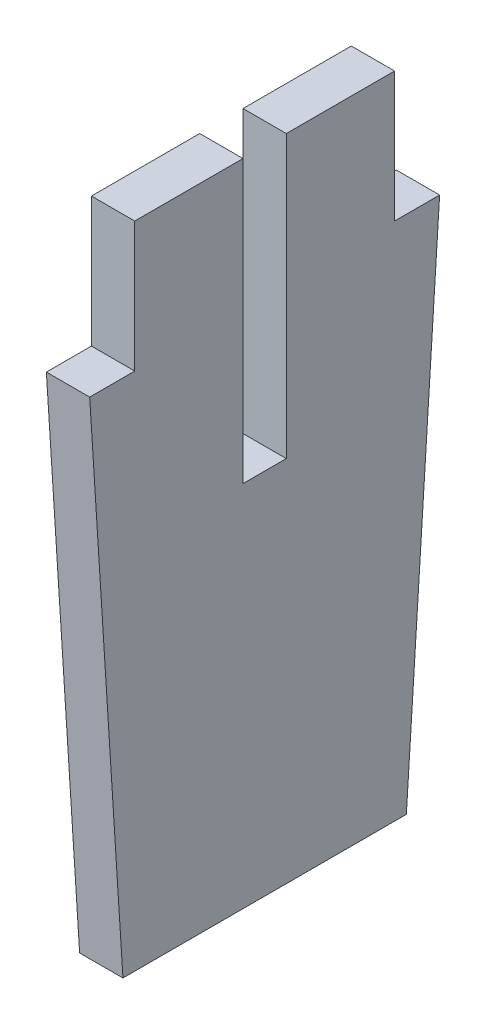
from build123d import *

# Parameters (mm, degrees)
BOSS_EXTRUDE1_DEPTH = 3.175


with BuildPart() as part:
    # Sketch1 → Boss-Extrude1 (new body)
    with BuildSketch(Plane(origin=(0, 0, 0), x_dir=(0, 0, -1), z_dir=(1, 0, 0))):
        Polygon((0, 47.625), (7.9375, 47.625), (7.9375, 26.9875), (11.1125, 26.9875), (11.1125, 47.625), (19.05, 47.625), (19.05, 38.1), (22.352, 38.1), (20.32, 6.35), (19.9136, 0), (-0.8636, 0), (-1.27, 6.35), (-3.302, 38.1), (0, 38.1), align=None)
    extrude(amount=BOSS_EXTRUDE1_DEPTH)


solid = part.part
